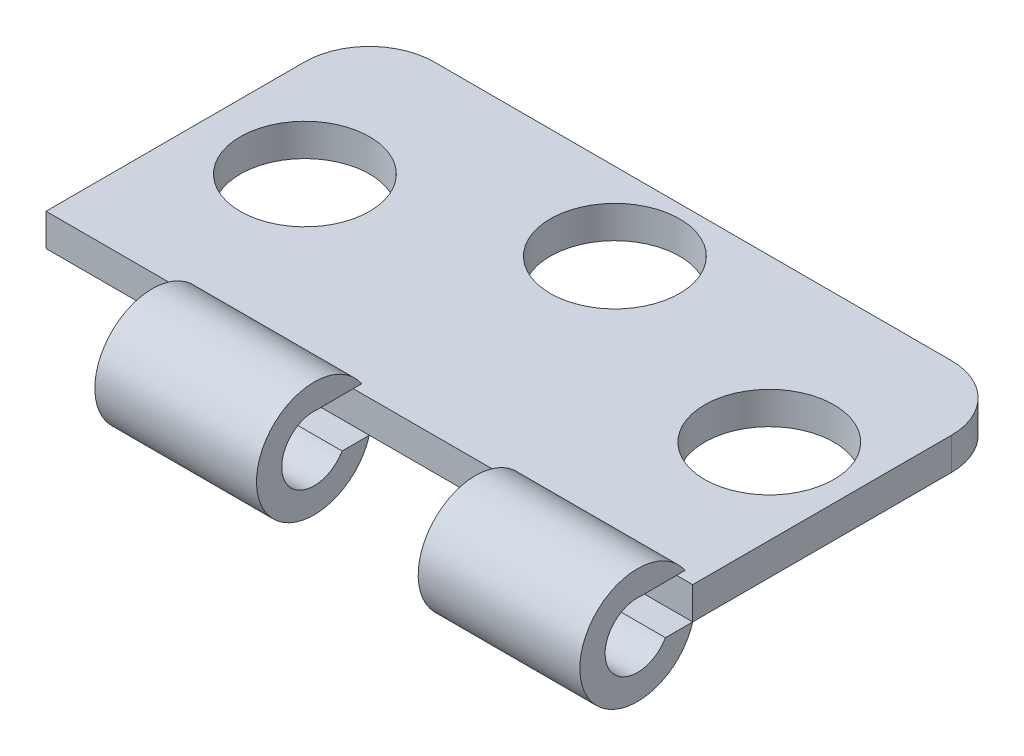
from build123d import *

# Parameters (mm, degrees)
SKETCH2_R           = 20
BOSS_EXTRUDE2_DEPTH = 10
BOSS_EXTRUDE5_DEPTH = 50
LPATTERN1_COUNT     = 2
LPATTERN1_PITCH     = 100


with BuildPart() as part:
    # Sketch2 → Boss-Extrude2 (new body)
    with BuildSketch(Plane(origin=(0, 0, 0), x_dir=(1, 0, 0), z_dir=(0, 1, 0))):
        with BuildLine():
            Line((-100, -50), (100, -50))
            Line((100, -50), (100, 30))
            ThreePointArc((100, 30), (94.142135624, 44.142135624), (80, 50))
            Line((80, 50), (-80, 50))
            ThreePointArc((-80, 50), (-94.142135624, 44.142135624), (-100, 30))
            Line((-100, 30), (-100, -50))
        make_face()
        with Locations(Location((0, 25.939849624, 0), (0, 0, 270))):
            Circle(SKETCH2_R, mode=Mode.SUBTRACT)
        with Locations(Location((73.684210526, 0, 0), (0, 0, 270))):
            Circle(SKETCH2_R, mode=Mode.SUBTRACT)
        with Locations(Location((-69.92481203, 0, 0), (0, 0, 270))):
            Circle(SKETCH2_R, mode=Mode.SUBTRACT)
    extrude(amount=BOSS_EXTRUDE2_DEPTH)


with BuildPart() as body_2:
    # Sketch3 → Boss-Extrude5 (new body)
    with BuildSketch(Plane(origin=(100, 0, 0), x_dir=(0, 0, -1), z_dir=(1, 0, 0))):
        with BuildLine():
            ThreePointArc((-52.349669205, 14.990309114), (-84.688048426, 2.242096338), (-50, 0))
            Line((-50, 0), (-58.433050285, 0))
            ThreePointArc((-58.433050285, 0), (-76.026046531, 0.504878572), (-65.948228442, 14.934223736))
            Line((-65.948228442, 14.934223736), (-52.349669205, 14.990309114))
        make_face()
    boss_extrude5 = extrude(amount=-BOSS_EXTRUDE5_DEPTH)


with BuildPart() as lpattern1_1:
    # LPattern1: Boss-Extrude5 ×2
    with Locations(*[(-i * LPATTERN1_PITCH, 0, 0) for i in range(1, LPATTERN1_COUNT)]):
        add(boss_extrude5)


solid = Compound([part.part, body_2.part, lpattern1_1.part])
